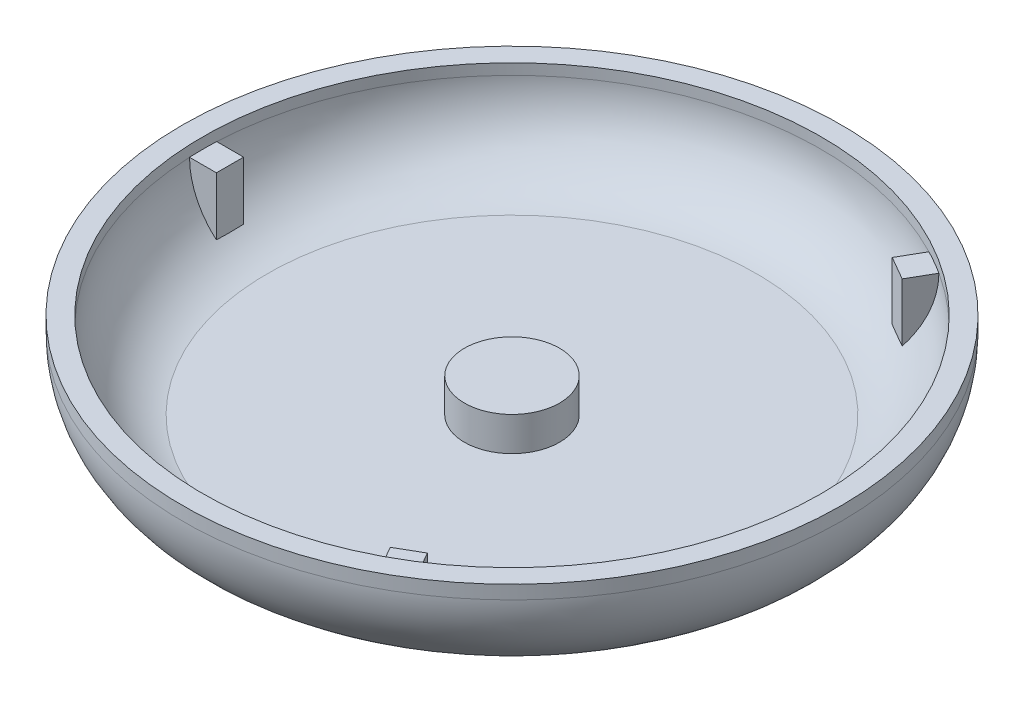
from build123d import *

# Parameters (mm, degrees)
BOSS_EXTRUDE2_REACH            = 37.012
BOSS_EXTRUDE2_END_MAJOR_RADIUS = 17.132631579
BOSS_EXTRUDE2_END_MINOR_RADIUS = 5.617368421
SKETCH4_W                      = 2
SKETCH4_H                      = 2
CIRPATTERN2_COUNT              = 3


with BuildPart() as part:
    # Sketch3 → Revolve1 (revolve)
    with BuildSketch(Plane.XY, mode=Mode.PRIVATE) as revolve1_sk:
        with BuildLine():
            Line((-24.25, 0), (-24.25, -1))
            ThreePointArc((-24.25, -1), (-22.452699724, -5.636404857), (-18, -7.85))
            Line((-18, -7.85), (0, -7.85))
            Line((0, -7.85), (0, -3.85))
            Line((0, -3.85), (-3.5, -3.85))
            Line((-3.5, -3.85), (-3.5, -6.35))
            Line((-3.5, -6.35), (-18, -6.35))
            ThreePointArc((-18, -6.35), (-21.400368447, -4.45256759), (-22.75, -0.8))
            Line((-22.75, -0.8), (-22.75, 0))
            Line((-22.75, 0), (-24.25, 0))
        make_face()
    revolve(revolve1_sk.sketch.rotate(Axis((0, -13.198525541, 0), (0, 1, 0)), 180), axis=Axis((0, -13.198525541, 0), (0, 1, 0)))

    # Boss-Extrude2: up to this torus (the profile starts inside it)
    boss_extrude2_end = Plane(origin=(0, -0.8, 0), z_dir=(0, -1, 0)) * Torus(BOSS_EXTRUDE2_END_MAJOR_RADIUS, BOSS_EXTRUDE2_END_MINOR_RADIUS, mode=Mode.PRIVATE)
    # Sketch4 → Boss-Extrude2 (add, up to the surface)
    with BuildSketch(Plane(origin=(0, -0.8, 0), x_dir=(1, 0, 0), z_dir=(0, 1, 0)), mode=Mode.PRIVATE) as boss_extrude2_sk1:
        with Locations((-21.75, 0)):
            Rectangle(SKETCH4_W, SKETCH4_H)
    boss_extrude2_tool1 = extrude(boss_extrude2_sk1.sketch, amount=-BOSS_EXTRUDE2_REACH, mode=Mode.PRIVATE) & boss_extrude2_end
    boss_extrude2 = boss_extrude2_tool1.solids().sort_by_distance((-21.75, -0.8, 0))[0]
    add(boss_extrude2)

    # CirPattern2: Boss-Extrude2 ×3 about axis
    cirpattern2_axis = Axis((0, 0, 0), (0, 1, 0))
    for i in range(1, CIRPATTERN2_COUNT):
        add(boss_extrude2.rotate(cirpattern2_axis, i * 360 / CIRPATTERN2_COUNT))


solid = part.part
